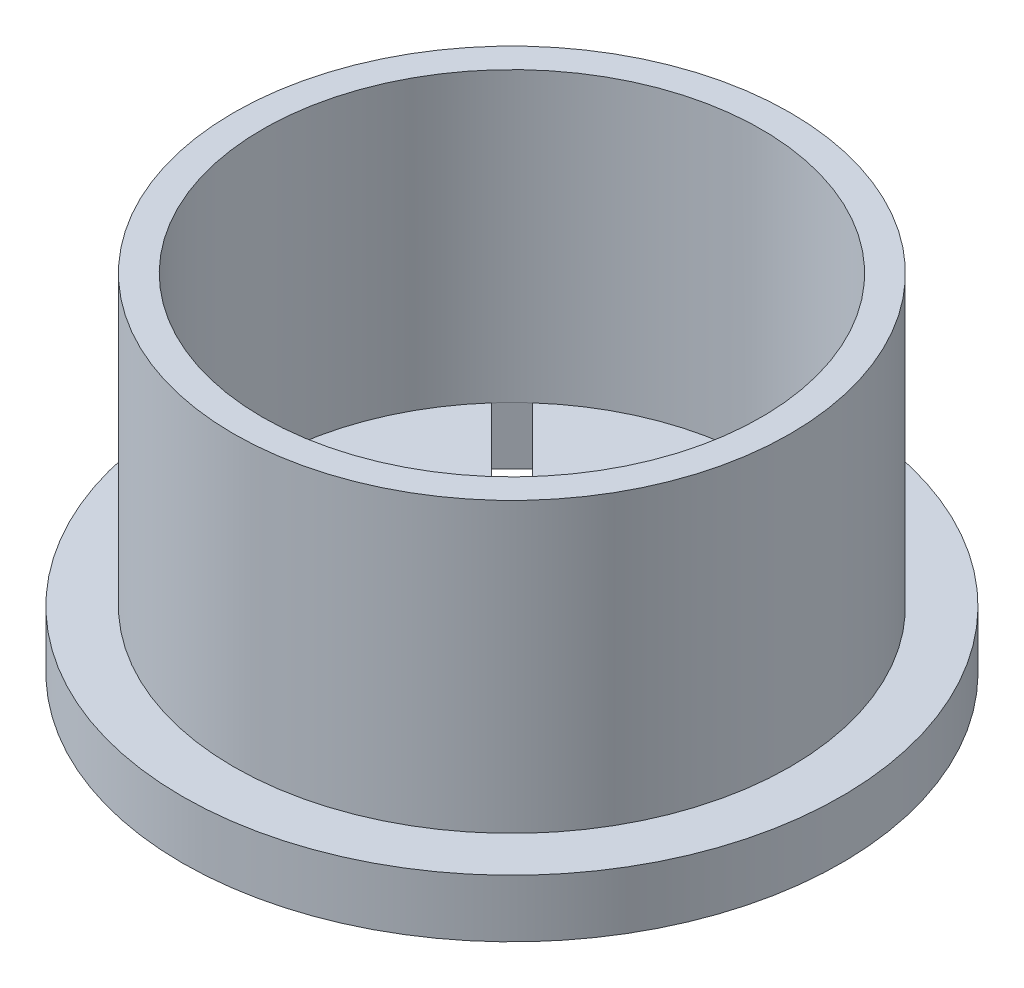
from build123d import *

# Parameters (mm, degrees)
SKETCH1_R           = 11.43
BOSS_EXTRUDE1_DEPTH = 2
SKETCH2_W           = 17.3
SKETCH2_H           = 1
SKETCH2_W_2         = 1
SKETCH2_H_2         = 17.3
CUT_EXTRUDE7_DEPTH  = 2
SKETCH3_R           = 9.65
BOSS_EXTRUDE2_DEPTH = 10
SKETCH4_R           = 8.65
CUT_EXTRUDE8_DEPTH  = 10


with BuildPart() as part:
    # Sketch1 → Boss-Extrude1 (new body)
    with BuildSketch(Plane(origin=(0, 0, 0), x_dir=(1, 0, 0), z_dir=(0, 1, 0))):
        Circle(SKETCH1_R)
    extrude(amount=BOSS_EXTRUDE1_DEPTH)

    # Sketch2 → Cut-Extrude7 (cut)
    with BuildSketch(Plane(origin=(0, 2, 0), x_dir=(1, 0, 0), z_dir=(0, 1, 0))):
        Polygon((-6.470027048, 5.762920267), (5.762920267, -6.470027048), (6.470027048, -5.762920267), (-5.762920267, 6.470027048), align=None)
        Rectangle(SKETCH2_W, SKETCH2_H)
        Rectangle(SKETCH2_W_2, SKETCH2_H_2)
        Polygon((5.762920267, 6.470027048), (-6.470027048, -5.762920267), (-5.762920267, -6.470027048), (6.470027048, 5.762920267), align=None)
    extrude(amount=-CUT_EXTRUDE7_DEPTH, mode=Mode.SUBTRACT)

    # Sketch3 → Boss-Extrude2 (add)
    with BuildSketch(Plane(origin=(0, 2, 0), x_dir=(1, 0, 0), z_dir=(0, 1, 0))):
        Circle(SKETCH3_R)
    extrude(amount=BOSS_EXTRUDE2_DEPTH)

    # Sketch4 → Cut-Extrude8 (cut)
    with BuildSketch(Plane(origin=(0, 12, 0), x_dir=(1, 0, 0), z_dir=(0, 1, 0))):
        Circle(SKETCH4_R)
    extrude(amount=-CUT_EXTRUDE8_DEPTH, mode=Mode.SUBTRACT)


solid = part.part
